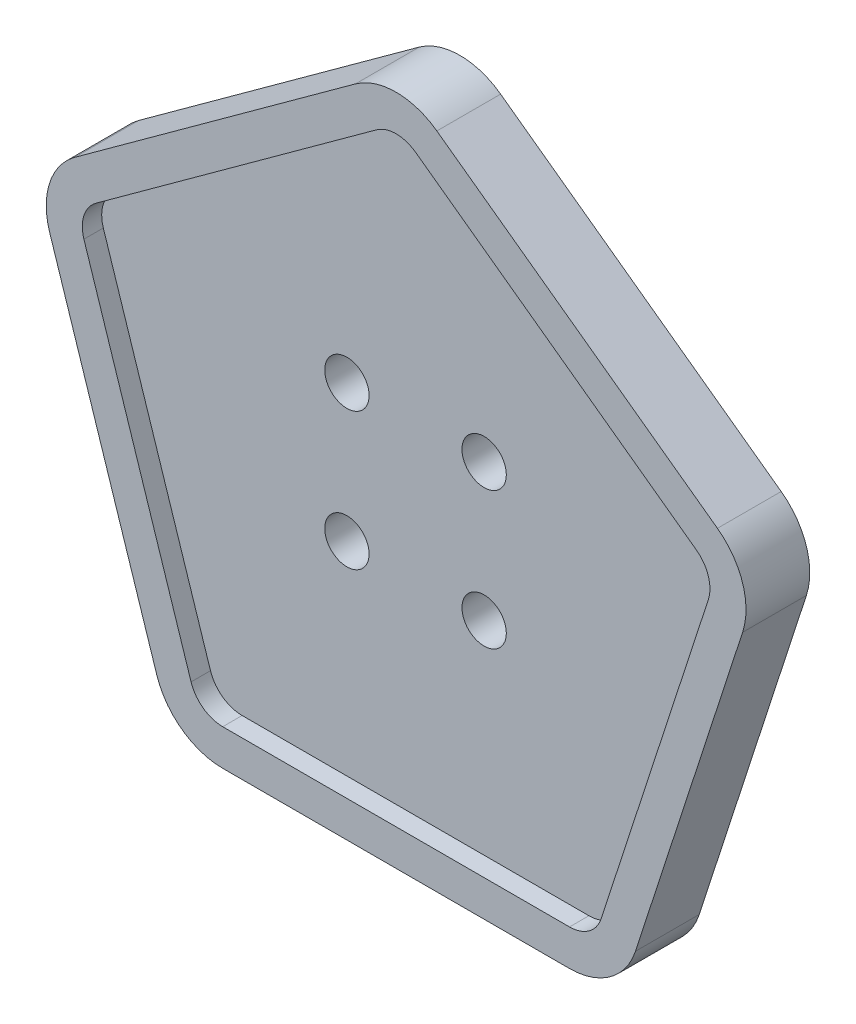
from build123d import *

# Parameters (mm, degrees)
SKETCH1_R           = 1.6
BOSS_EXTRUDE1_DEPTH = 4.6
CUT_EXTRUDE2_DEPTH  = 1.4


with BuildPart() as part:
    # Sketch1 → Boss-Extrude1 (new body)
    with BuildSketch(Plane.XY):
        with BuildLine():
            Line((-2.938926261, 25.327361545), (-23.179574078, 10.621670112))
            ThreePointArc((-23.179574078, 10.621670112), (-24.995930398, 8.121670112), (-24.995930398, 5.031500168))
            Line((-24.995930398, 5.031500168), (-17.264690886, -18.762808399))
            ThreePointArc((-17.264690886, -18.762808399), (-15.448334566, -21.262808399), (-12.509408305, -22.217723427))
            Line((-12.509408305, -22.217723427), (12.509408305, -22.217723427))
            ThreePointArc((12.509408305, -22.217723427), (15.448334566, -21.262808399), (17.264690886, -18.762808399))
            Line((17.264690886, -18.762808399), (24.995930398, 5.031500168))
            ThreePointArc((24.995930398, 5.031500168), (24.995930398, 8.121670112), (23.179574078, 10.621670112))
            Line((23.179574078, 10.621670112), (2.938926261, 25.327361545))
            ThreePointArc((2.938926261, 25.327361545), (0, 26.282276573), (-2.938926261, 25.327361545))
        make_face()
        with Locations((-4.949747468, 4.949747468)):
            Circle(SKETCH1_R, mode=Mode.SUBTRACT)
        with Locations((4.949747468, 4.949747468)):
            Circle(SKETCH1_R, mode=Mode.SUBTRACT)
        with Locations((4.949747468, -4.949747468)):
            Circle(SKETCH1_R, mode=Mode.SUBTRACT)
        with Locations((-4.949747468, -4.949747468)):
            Circle(SKETCH1_R, mode=Mode.SUBTRACT)
    extrude(amount=BOSS_EXTRUDE1_DEPTH)

    # Sketch3 → Cut-Extrude2 (cut)
    with BuildSketch(Plane.XY.offset(4.6)):
        with BuildLine():
            Line((-22.523183456, 5.834944354), (-14.791943944, -17.959364213))
            ThreePointArc((-14.791943944, -17.959364213), (-13.92009291, -19.159364213), (-12.509408305, -19.617723427))
            Line((-12.509408305, -19.617723427), (12.509408305, -19.617723427))
            ThreePointArc((12.509408305, -19.617723427), (13.92009291, -19.159364213), (14.791943944, -17.959364213))
            Line((14.791943944, -17.959364213), (22.523183456, 5.834944354))
            ThreePointArc((22.523183456, 5.834944354), (22.523183456, 7.318225927), (21.651332422, 8.518225927))
            Line((21.651332422, 8.518225927), (1.410684606, 23.22391736))
            ThreePointArc((1.410684606, 23.22391736), (0, 23.682276573), (-1.410684606, 23.22391736))
            Line((-1.410684606, 23.22391736), (-21.651332422, 8.518225927))
            ThreePointArc((-21.651332422, 8.518225927), (-22.523183456, 7.318225927), (-22.523183456, 5.834944354))
        make_face()
    extrude(amount=-CUT_EXTRUDE2_DEPTH, mode=Mode.SUBTRACT)


solid = part.part
